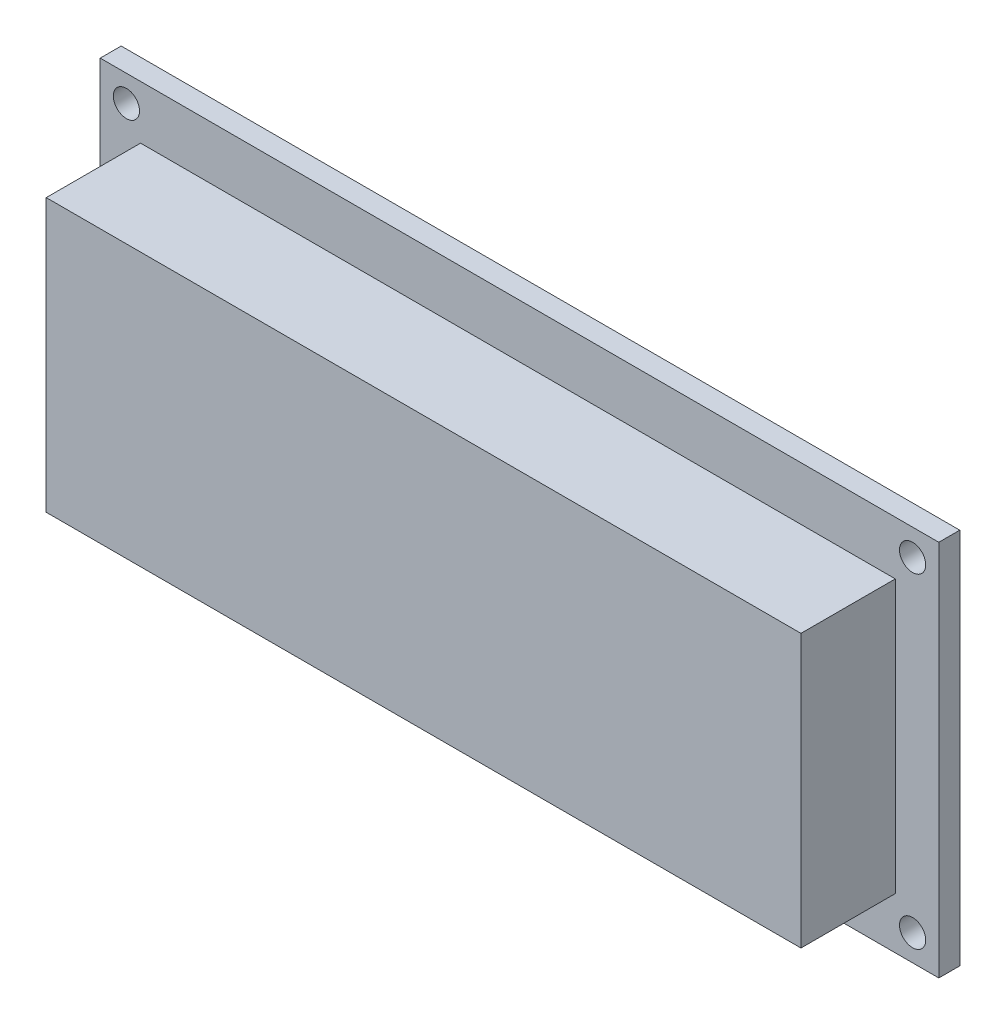
from build123d import *

# Parameters (mm, degrees)
SKETCH_1_W          = 80
SKETCH_1_H          = 36
EXTRUDE_1_DEPTH     = 2
SKETCH_2_W          = 72
SKETCH_2_H          = 26
EXTRUDE_2_DEPTH     = 9
SKETCH_3_R          = 1.25
CUT_EXTRUDE_1_DEPTH = 66.831593266


with BuildPart() as part:
    # Эскиз1 → Бобышка-Вытянуть1 (new body)
    with BuildSketch(Plane.XY):
        with Locations((21.254780468, -4.375221601)):
            Rectangle(SKETCH_1_W, SKETCH_1_H)
    extrude(amount=EXTRUDE_1_DEPTH)

    # Эскиз2 → Бобышка-Вытянуть2 (add)
    with BuildSketch(Plane.XY.offset(2)):
        with Locations((21.104780468, -4.475221601)):
            Rectangle(SKETCH_2_W, SKETCH_2_H)
    extrude(amount=EXTRUDE_2_DEPTH)

    # Эскиз3 → Вырез-Вытянуть1 (cut, through all)
    with BuildSketch(Plane.XY.offset(2)):
        with Locations((-16.245219532, 11.124778399)):
            Circle(SKETCH_3_R)
        with Locations((58.754780468, 11.124778399)):
            Circle(SKETCH_3_R)
        with Locations((58.754780468, -19.875221601)):
            Circle(SKETCH_3_R)
        with Locations((-16.245219532, -19.875221601)):
            Circle(SKETCH_3_R)
    extrude(amount=-CUT_EXTRUDE_1_DEPTH, mode=Mode.SUBTRACT)


solid = part.part
